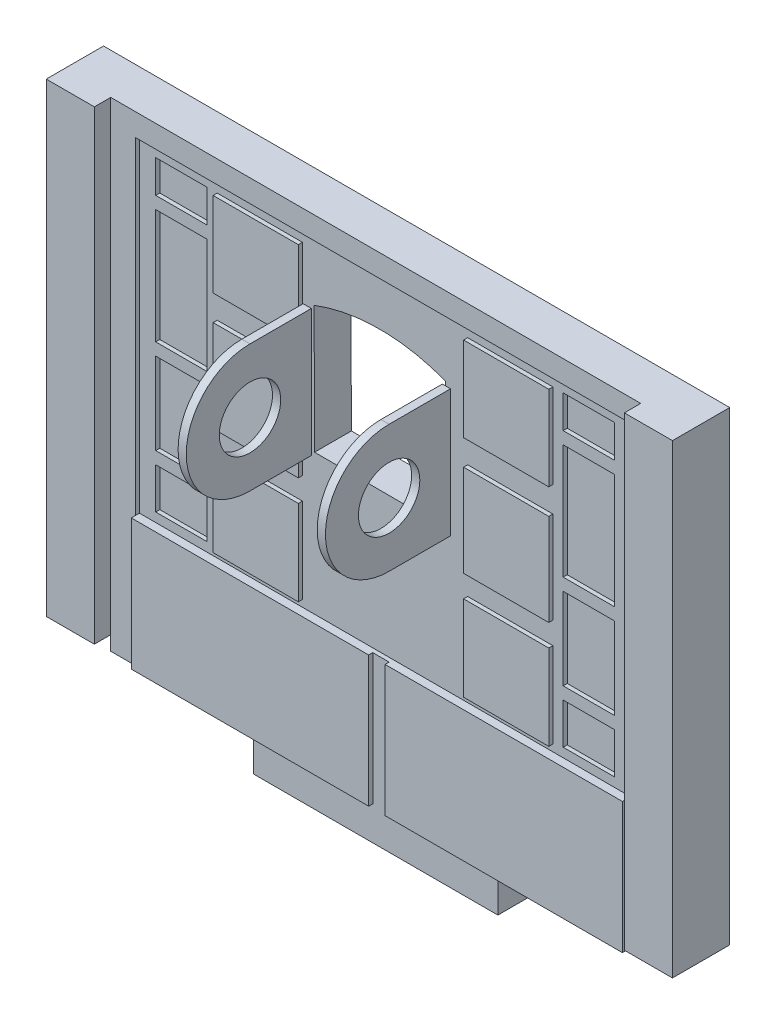
from build123d import *

# Parameters (mm, degrees)
BOSS_EXTRUDE1_DEPTH = 10
CUT_EXTRUDE1_DEPTH  = 60
SKETCH8_R           = 7.5
BOSS_EXTRUDE4_DEPTH = 2
BOSS_EXTRUDE5_START = -2
SKETCH9_R           = 7.5
BOSS_EXTRUDE5_DEPTH = 2
SKETCH2_W           = 11.75
SKETCH2_H           = 134.399993897
BOSS_EXTRUDE6_DEPTH = 4
SKETCH11_W          = 12.5
SKETCH11_H          = 8
SKETCH11_H_2        = 28
SKETCH11_H_3        = 20
SKETCH11_H_4        = 10
CUT_EXTRUDE2_DEPTH  = 2
SKETCH12_W          = 120
SKETCH12_H          = 80
CUT_EXTRUDE4_DEPTH  = 1
SKETCH14_W          = 20.819436715
SKETCH14_H          = 20.654659611
SKETCH14_H_2        = 22.463076456
SKETCH14_H_3        = 20.818440047
BOSS_EXTRUDE7_DEPTH = 1
SKETCH15_W          = 58
SKETCH15_H          = 32
BOSS_EXTRUDE8_DEPTH = 1
SKETCH16_W          = 11.75
SKETCH16_H          = 20.68871607
CUT_EXTRUDE5_DEPTH  = 30


with BuildPart() as part:
    # Sketch1 → Boss-Extrude1 (new body)
    with BuildSketch(Plane.XY):
        Polygon((-66.024135719, -56.369843335), (-77.774135719, -56.369843335), (-77.774135719, 78.030150562), (75.225864281, 78.030150562), (75.225864281, -56.369843335), (63.475864281, -56.369843335), (63.475864281, -39.169831128), (28.575870384, -39.169831128), (28.575870384, -47.699860425), (-31.124141823, -47.699860425), (-31.124141823, -39.169831128), (-66.024135719, -39.169831128), align=None)
    extrude(amount=BOSS_EXTRUDE1_DEPTH)

    # Sketch3 → Cut-Extrude1 (cut)
    with BuildSketch(Plane.XY.offset(10)):
        with BuildLine():
            Line((-17.218593727, 26.855220573), (14.781406273, 26.764980095))
            Line((14.781406273, 26.764980095), (14.781406273, 57.885585563))
            ThreePointArc((14.781406273, 57.885585563), (-1.274135719, 60.852645916), (-17.329677711, 57.885585563))
            Line((-17.329677711, 57.885585563), (-17.218593727, 26.855220573))
        make_face()
    extrude(amount=-CUT_EXTRUDE1_DEPTH, mode=Mode.SUBTRACT)

    # Sketch8 → Boss-Extrude4 (add)
    with BuildSketch(Plane(origin=(15, 0, 0), x_dir=(0, 0, -1), z_dir=(1, 0, 0))):
        with BuildLine():
            Line((-10, 26.764980095), (-10, 57.885585563))
            Line((-10, 57.885585563), (-25, 57.885585563))
            ThreePointArc((-25, 57.885585563), (-40.560302734, 42.325282829), (-25, 26.764980095))
            Line((-25, 26.764980095), (-10, 26.764980095))
        make_face()
        with Locations((-25, 42.325282829)):
            Circle(SKETCH8_R, mode=Mode.SUBTRACT)
    extrude(amount=BOSS_EXTRUDE4_DEPTH)

    # Sketch9 → Boss-Extrude5 (add)
    with BuildSketch(Plane(origin=(-17, 0, 0), x_dir=(0, 0, -1), z_dir=(1, 0, 0)).offset(BOSS_EXTRUDE5_START)):
        with BuildLine():
            Line((-10, 57.885585563), (-25, 57.885585563))
            ThreePointArc((-25, 57.885585563), (-40.560302734, 42.325282829), (-25, 26.764980095))
            Line((-25, 26.764980095), (-10, 26.764980095))
            Line((-10, 26.764980095), (-10, 57.885585563))
        make_face()
        with Locations((-25, 42.325282829)):
            Circle(SKETCH9_R, mode=Mode.SUBTRACT)
    extrude(amount=BOSS_EXTRUDE5_DEPTH)

    # Sketch2 → Boss-Extrude6 (add)
    with BuildSketch(Plane.XY.offset(10)):
        with Locations((69.350864281, 10.830153613)):
            Rectangle(SKETCH2_W, SKETCH2_H)
        with Locations((-71.899135719, 10.830153613)):
            Rectangle(SKETCH2_W, SKETCH2_H)
    extrude(amount=BOSS_EXTRUDE6_DEPTH)

    # Sketch11 → Cut-Extrude2 (cut)
    with BuildSketch(Plane.XY.offset(10)):
        with Locations((-49.774135719, 65.792146082)):
            Rectangle(SKETCH11_W, SKETCH11_H)
        with Locations((-49.774135719, 44.792146082)):
            Rectangle(SKETCH11_W, SKETCH11_H_2)
        with Locations((-49.774135719, 17.792146082)):
            Rectangle(SKETCH11_W, SKETCH11_H_3)
        with Locations((-49.774135719, -0.207853918)):
            Rectangle(SKETCH11_W, SKETCH11_H_4)
        with Locations((49.774135719, -0.207853918)):
            Rectangle(SKETCH11_W, SKETCH11_H_4)
        with Locations((49.774135719, 17.792146082)):
            Rectangle(SKETCH11_W, SKETCH11_H_3)
        with Locations((49.774135719, 44.792146082)):
            Rectangle(SKETCH11_W, SKETCH11_H_2)
        with Locations((49.774135719, 65.792146082)):
            Rectangle(SKETCH11_W, SKETCH11_H)
    extrude(amount=-CUT_EXTRUDE2_DEPTH, mode=Mode.SUBTRACT)

    # Sketch12 → Cut-Extrude4 (cut)
    with BuildSketch(Plane.XY.offset(10)):
        with Locations((0, 32.562566027)):
            Rectangle(SKETCH12_W, SKETCH12_H)
    extrude(amount=-CUT_EXTRUDE4_DEPTH, mode=Mode.SUBTRACT)


with BuildPart() as cut_extrude4_piece_1:
    # of the separate pieces the step leaves, piece 1, a body of its own (cut_extrude4_pieces)
    add(part.part.solids().sort_by_distance((-66.024135719, -56.369843335, 0))[0])

    # Sketch14 → Boss-Extrude7 (add)
    with BuildSketch(Plane.XY.offset(9)):
        with Locations((-30.597905478, 59.464816277)):
            Rectangle(SKETCH14_W, SKETCH14_H)
        with Locations((-30.597905478, 31.660117229)):
            Rectangle(SKETCH14_W, SKETCH14_H_2)
        with Locations((-30.597905478, 4.62341571)):
            Rectangle(SKETCH14_W, SKETCH14_H_3)
        with Locations((30.597905478, 31.660117229)):
            Rectangle(SKETCH14_W, SKETCH14_H_2)
        with Locations((30.597905478, 59.464816277)):
            Rectangle(SKETCH14_W, SKETCH14_H)
        with Locations((30.597905478, 4.62341571)):
            Rectangle(SKETCH14_W, SKETCH14_H_3)
    extrude(amount=BOSS_EXTRUDE7_DEPTH)

    # Sketch15 → Boss-Extrude8 (add)
    with BuildSketch(Plane.XY.offset(10)):
        with Locations((-31, -23.437433973)):
            Rectangle(SKETCH15_W, SKETCH15_H)
        with Locations((31, -23.437433973)):
            Rectangle(SKETCH15_W, SKETCH15_H)
    extrude(amount=BOSS_EXTRUDE8_DEPTH)

    # Sketch16 → Cut-Extrude5 (cut)
    with BuildSketch(Plane.XY.offset(14)):
        with Locations((-71.899135719, -46.0254853)):
            Rectangle(SKETCH16_W, SKETCH16_H)
        with Locations((69.350864281, -46.0254853)):
            Rectangle(SKETCH16_W, SKETCH16_H)
    extrude(amount=-CUT_EXTRUDE5_DEPTH, mode=Mode.SUBTRACT)


with BuildPart() as cut_extrude4_piece_2:
    # of the separate pieces the step leaves, piece 2, a body of its own (cut_extrude4_pieces)
    add(part.part.solids().sort_by_distance((15, 26.764980095, 25))[0])


with BuildPart() as cut_extrude4_piece_3:
    # of the separate pieces the step leaves, piece 3, a body of its own (cut_extrude4_pieces)
    add(part.part.solids().sort_by_distance((-17, 26.764980095, 25))[0])


solid = Compound([cut_extrude4_piece_1.part, cut_extrude4_piece_2.part, cut_extrude4_piece_3.part])
